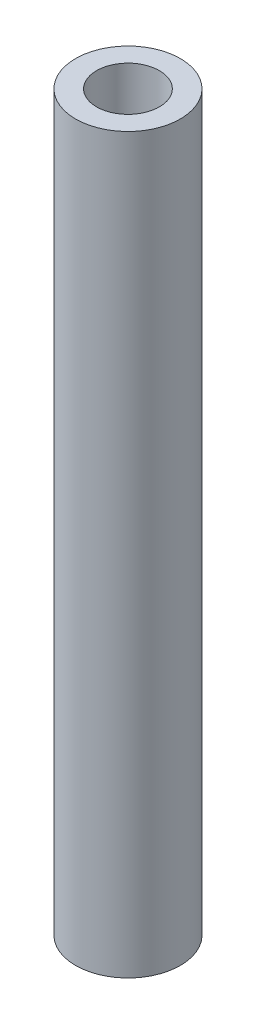
from build123d import *

# Parameters (mm, degrees)
SKETCH1_R           = 2.5
SKETCH1_R_2         = 1.5
BOSS_EXTRUDE1_DEPTH = 35


with BuildPart() as part:
    # Sketch1 → Boss-Extrude1 (new body)
    with BuildSketch(Plane(origin=(0, 0, 0), x_dir=(1, 0, 0), z_dir=(0, 1, 0))):
        with Locations(Location((0, 0, 0), (0, 0, 270))):
            Circle(SKETCH1_R)
        with Locations(Location((0, 0, 0), (0, 0, 270))):
            Circle(SKETCH1_R_2, mode=Mode.SUBTRACT)
    extrude(amount=BOSS_EXTRUDE1_DEPTH)


solid = part.part
